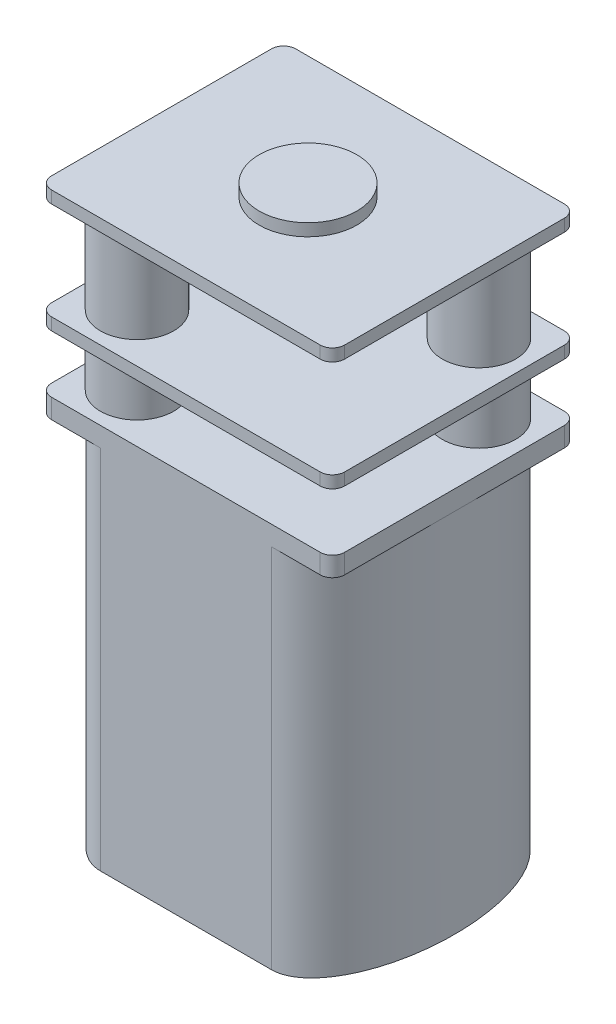
from build123d import *

# Parameters (mm, degrees)
SKETCH1_W           = 7
SKETCH1_H           = 10
BOSS_EXTRUDE1_DEPTH = 15
BOSS_EXTRUDE2_DEPTH = 0.8
SKETCH3_R           = 1.5
BOSS_EXTRUDE3_DEPTH = 7.35
BOSS_EXTRUDE4_DEPTH = 0.5
BOSS_EXTRUDE5_DEPTH = 0.5
SKETCH7_R           = 2
BOSS_EXTRUDE6_DEPTH = 0.5


with BuildPart() as part:
    # Sketch1 → Boss-Extrude1 (new body)
    with BuildSketch(Plane(origin=(0, 0, 0), x_dir=(1, 0, 0), z_dir=(0, 1, 0))):
        with BuildLine():
            Line((-3.5, -5), (-3.5, 5))
            add(Edge.make_bspline(
                [(-3.5, 5), (-6.002556946, 5), (-6.002556946, 0), (-6.002556946, -5), (-3.5, -5)],
                knots=[0, 0, 0, 1.570796327, 1.570796327, 3.141592654, 3.141592654, 3.141592654], degree=2, weights=[1, 0.707106781, 1, 0.707106781, 1]))
        make_face()
        Rectangle(SKETCH1_W, SKETCH1_H)
        with BuildLine():
            Line((3.5, -5), (3.5, 5))
            add(Edge.make_bspline(
                [(3.5, -5), (6.000509097, -5), (6.000509097, 0), (6.000509097, 5), (3.5, 5)],
                knots=[3.141592654, 3.141592654, 3.141592654, 4.71238898, 4.71238898, 6.283185307, 6.283185307, 6.283185307], degree=2, weights=[1, 0.707106781, 1, 0.707106781, 1]))
        make_face()
    extrude(amount=BOSS_EXTRUDE1_DEPTH)

    # Sketch2 → Boss-Extrude2 (add)
    with BuildSketch(Plane(origin=(0, 15, 0), x_dir=(1, 0, 0), z_dir=(0, 1, 0))):
        with BuildLine():
            Line((-5.5, -5), (5.5, -5))
            ThreePointArc((5.5, -5), (5.853553391, -4.853553391), (6, -4.5))
            Line((6, -4.5), (6, 4.5))
            ThreePointArc((6, 4.5), (5.853553391, 4.853553391), (5.5, 5))
            Line((5.5, 5), (-5.5, 5))
            ThreePointArc((-5.5, 5), (-5.853553391, 4.853553391), (-6, 4.5))
            Line((-6, 4.5), (-6, -4.5))
            ThreePointArc((-6, -4.5), (-5.853553391, -4.853553391), (-5.5, -5))
        make_face()
    extrude(amount=BOSS_EXTRUDE2_DEPTH)

    # Sketch3 → Boss-Extrude3 (add)
    with BuildSketch(Plane(origin=(0, 15.8, 0), x_dir=(1, 0, 0), z_dir=(0, 1, 0))):
        with Locations(Location((4, 3, 0), (0, 0, 90))):
            Circle(SKETCH3_R)
        with Locations(Location((-4, -3, 0), (0, 0, 90))):
            Circle(SKETCH3_R)
    extrude(amount=BOSS_EXTRUDE3_DEPTH)

    # Sketch4 → Boss-Extrude4 (add)
    with BuildSketch(Plane(origin=(0, 18.15, 0), x_dir=(1, 0, 0), z_dir=(0, 1, 0))):
        with BuildLine():
            Line((-1.5, 4.5), (-1.5, 0.8))
            ThreePointArc((-1.5, 0.8), (-1.646446609, 0.446446609), (-2, 0.3))
            Line((-2, 0.3), (-5.5, 0.3))
            ThreePointArc((-5.5, 0.3), (-5.853553391, 0.153553391), (-6, -0.2))
            Line((-6, -0.2), (-6, -4.5))
            ThreePointArc((-6, -4.5), (-5.853553391, -4.853553391), (-5.5, -5))
            Line((-5.5, -5), (5.5, -5))
            ThreePointArc((5.5, -5), (5.853553391, -4.853553391), (6, -4.5))
            Line((6, -4.5), (6, 4.5))
            ThreePointArc((6, 4.5), (5.853553391, 4.853553391), (5.5, 5))
            Line((5.5, 5), (-1, 5))
            ThreePointArc((-1, 5), (-1.353553391, 4.853553391), (-1.5, 4.5))
        make_face()
    extrude(amount=BOSS_EXTRUDE4_DEPTH)

    # Sketch6 → Boss-Extrude5 (add)
    with BuildSketch(Plane(origin=(0, 22.65, 0), x_dir=(1, 0, 0), z_dir=(0, 1, 0))):
        with BuildLine():
            Line((-5.5, -5), (5.5, -5))
            ThreePointArc((5.5, -5), (5.853553391, -4.853553391), (6, -4.5))
            Line((6, -4.5), (6, 4.5))
            ThreePointArc((6, 4.5), (5.853553391, 4.853553391), (5.5, 5))
            Line((5.5, 5), (-5.5, 5))
            ThreePointArc((-5.5, 5), (-5.853553391, 4.853553391), (-6, 4.5))
            Line((-6, 4.5), (-6, -4.5))
            ThreePointArc((-6, -4.5), (-5.853553391, -4.853553391), (-5.5, -5))
        make_face()
    extrude(amount=BOSS_EXTRUDE5_DEPTH)

    # Sketch7 → Boss-Extrude6 (add)
    with BuildSketch(Plane(origin=(0, 23.15, 0), x_dir=(1, 0, 0), z_dir=(0, 1, 0))):
        with Locations(Location((0, 0, 0), (0, 0, 270))):
            Circle(SKETCH7_R)
    extrude(amount=BOSS_EXTRUDE6_DEPTH)


solid = part.part
